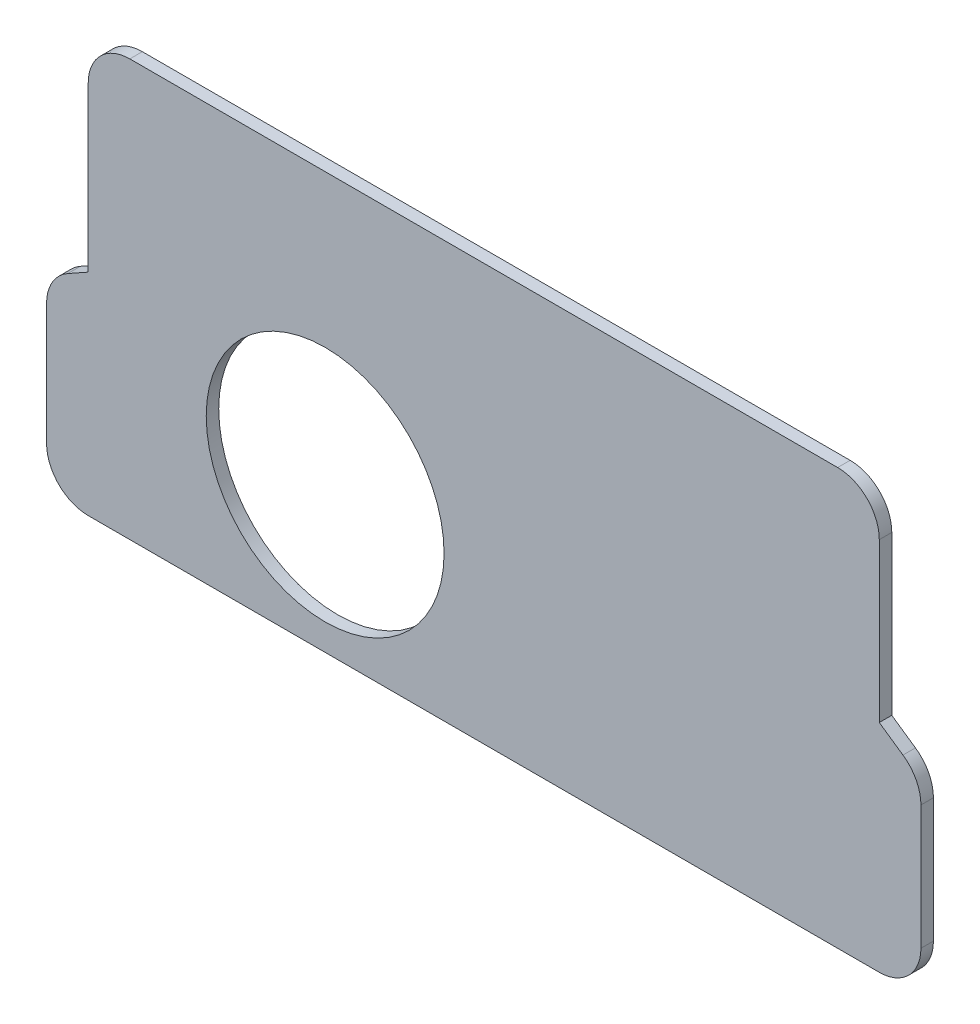
from build123d import *

# Parameters (mm, degrees)
SKETCH_1_R      = 28.563178004
EXTRUDE_1_DEPTH = 3


with BuildPart() as part:
    # 草图1 → 凸台-拉伸1 (new body)
    with BuildSketch(Plane.XY):
        with BuildLine():
            Line((0, 10), (0, 39.186569494))
            ThreePointArc((0, 39.186569494), (1.375838219, 44.248568464), (5.124766715, 47.917669105))
            Line((5.124766715, 47.917669105), (10, 50.639880584))
            Line((10, 50.639880584), (10, 90))
            ThreePointArc((10, 90), (12.928932188, 97.071067812), (20, 100))
            Line((20, 100), (190, 100))
            ThreePointArc((190, 100), (197.071067812, 97.071067812), (200, 90))
            Line((200, 90), (200, 51.963395008))
            Line((200, 51.963395008), (205.683304945, 48.037782396))
            ThreePointArc((205.683304945, 48.037782396), (208.855310538, 44.455580593), (210, 39.809778695))
            Line((210, 39.809778695), (210, 10))
            ThreePointArc((210, 10), (207.071067812, 2.928932188), (200, 0))
            Line((200, 0), (10, 0))
            ThreePointArc((10, 0), (2.928932188, 2.928932188), (0, 10))
        make_face()
        with Locations((66.906627039, 34.890553548)):
            Circle(SKETCH_1_R, mode=Mode.SUBTRACT)
    extrude(amount=EXTRUDE_1_DEPTH)


solid = part.part
